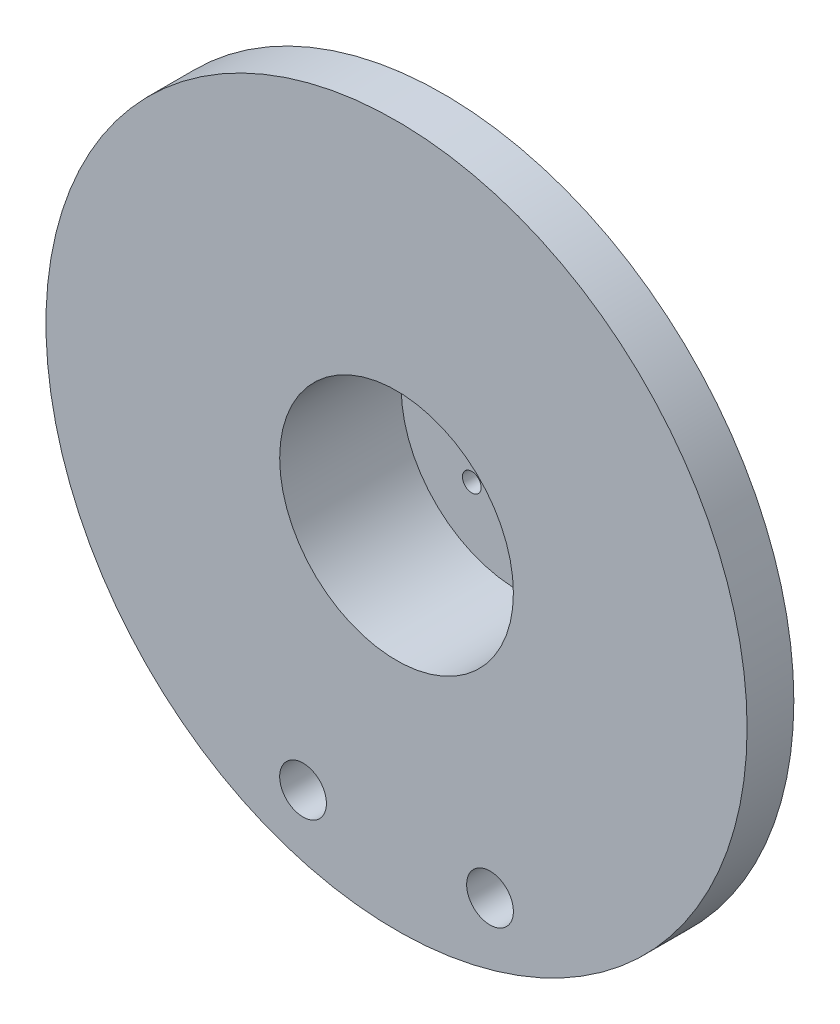
from build123d import *
from build123d.topology import SkipClean

# Parameters (mm, degrees)
SKETCH_1_R          = 37.5
SKETCH_1_R_2        = 12.5
EXTRUDE_1_DEPTH     = 5
EXTRUDE_START       = 13
SKETCH_2_R          = 17.5
SKETCH_2_R_2        = 12.5
EXTRUDE_2_DEPTH     = 13
SKETCH_3_R          = 12.5
SKETCH_3_R_2        = 5
SKETCH_3_R_3        = 1
EXTRUDE_3_DEPTH     = 5
SKETCH_4_R          = 2.5
CUT_EXTRUDE_1_DEPTH = 5


with BuildPart() as part:
    # 草图1 → 凸台-拉伸1 (new body)
    with BuildSketch(Plane.XY):
        Circle(SKETCH_1_R)
        Circle(SKETCH_1_R_2, mode=Mode.SUBTRACT)
    extrude(amount=EXTRUDE_1_DEPTH)

    # 草图2 → 凸台-拉伸2 (add)
    with SkipClean():  # the faces are left unmerged after this step: merging them gives an invalid solid
        with BuildSketch(Plane(origin=(0, 0, 0), x_dir=(-1, 0, 0), z_dir=(0, 0, -1)).offset(EXTRUDE_START)):
            with Locations(Location((0, 0, 0), (0, 0, 180))):
                Circle(SKETCH_2_R)
            Circle(SKETCH_2_R_2, mode=Mode.SUBTRACT)
        extrude(amount=-EXTRUDE_2_DEPTH)

    # 草图3 → 凸台-拉伸3 (add)
    with SkipClean():  # the faces are left unmerged after this step: merging them gives an invalid solid
        with BuildSketch(Plane(origin=(0, 0, -13), x_dir=(-1, 0, 0), z_dir=(0, 0, -1))):
            Circle(SKETCH_3_R)
            Circle(SKETCH_3_R_2, mode=Mode.SUBTRACT)
            with Locations((7, 0)):
                Circle(SKETCH_3_R_3, mode=Mode.SUBTRACT)
            with Locations((4.949747468, -4.949747468)):
                Circle(SKETCH_3_R_3, mode=Mode.SUBTRACT)
            with Locations((0, -7)):
                Circle(SKETCH_3_R_3, mode=Mode.SUBTRACT)
            with Locations((-4.949747468, -4.949747468)):
                Circle(SKETCH_3_R_3, mode=Mode.SUBTRACT)
            with Locations((-7, 0)):
                Circle(SKETCH_3_R_3, mode=Mode.SUBTRACT)
            with Locations((-4.949747468, 4.949747468)):
                Circle(SKETCH_3_R_3, mode=Mode.SUBTRACT)
            with Locations((0, 7)):
                Circle(SKETCH_3_R_3, mode=Mode.SUBTRACT)
            with Locations((4.949747468, 4.949747468)):
                Circle(SKETCH_3_R_3, mode=Mode.SUBTRACT)
        extrude(amount=-EXTRUDE_3_DEPTH)

    # 草图4 → 切除-拉伸1 (cut)
    with SkipClean():  # the faces are left unmerged after this step: merging them gives an invalid solid
        with BuildSketch(Plane.XY.offset(5)):
            with Locations((10, -29.5)):
                Circle(SKETCH_4_R)
            with Locations((-10, -29.5)):
                Circle(SKETCH_4_R)
        extrude(amount=-CUT_EXTRUDE_1_DEPTH, mode=Mode.SUBTRACT)


solid = part.part
